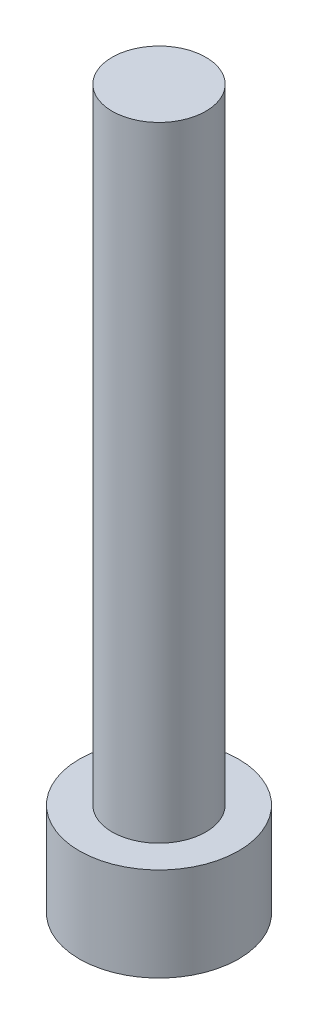
from build123d import *

# Parameters (mm, degrees)
SKETCH_1_R      = 5.1
EXTRUDE_1_DEPTH = 6
SKETCH_2_R      = 3
EXTRUDE_2_DEPTH = 40


with BuildPart() as part:
    # 草图1 → 凸台-拉伸1 (new body)
    with BuildSketch(Plane(origin=(0, 0, 0), x_dir=(1, 0, 0), z_dir=(0, 1, 0))):
        with Locations(Location((0, 0, 0), (0, 0, 270))):
            Circle(SKETCH_1_R)
    extrude(amount=EXTRUDE_1_DEPTH)

    # 草图2 → 凸台-拉伸2 (add)
    with BuildSketch(Plane(origin=(0, 6, 0), x_dir=(1, 0, 0), z_dir=(0, 1, 0))):
        with Locations(Location((0, 0, 0), (0, 0, 270))):
            Circle(SKETCH_2_R)
    extrude(amount=EXTRUDE_2_DEPTH)


solid = part.part
